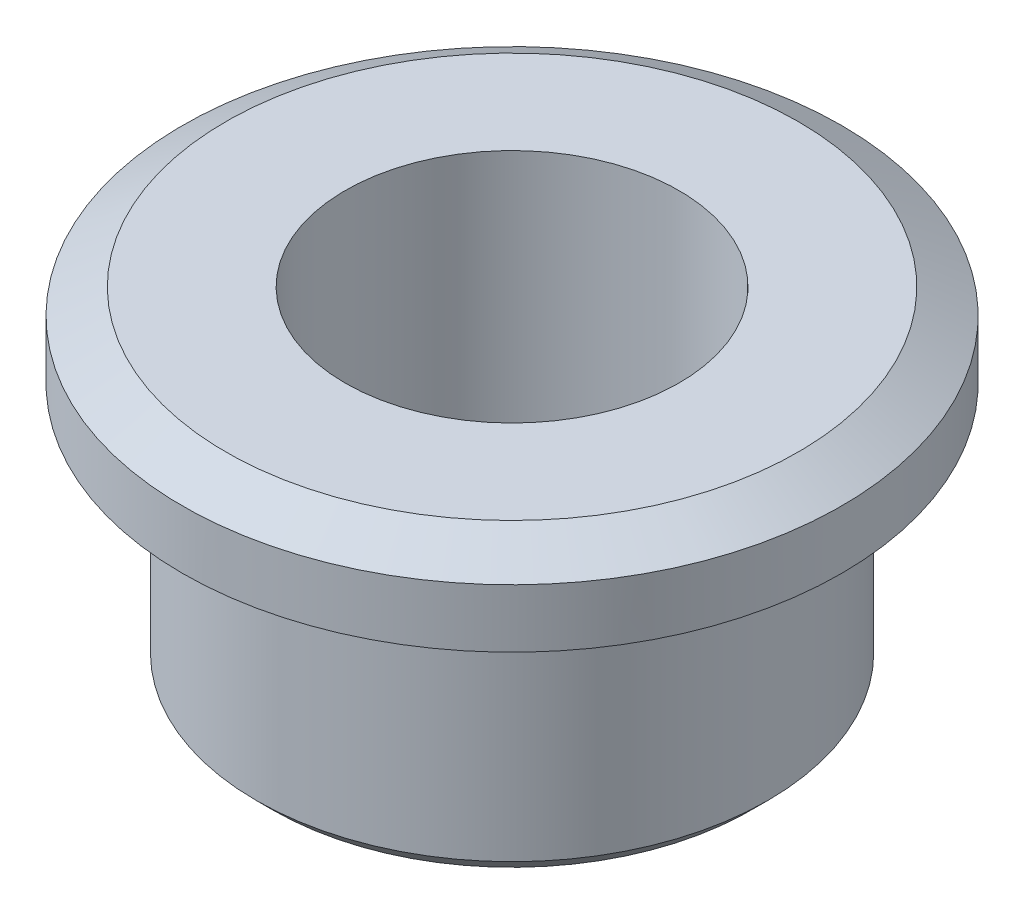
from build123d import *

# Parameters (mm, degrees)
SKETCH_1_R      = 3.065
SKETCH_1_R_2    = 2
EXTRUDE_1_DEPTH = 3
EXTRUDE_START   = 1
SKETCH_2_R      = 3.95
SKETCH_2_R_2    = 2
EXTRUDE_2_DEPTH = 1
CHAMFER_1_SIZE  = 0.3
CHAMFER_1_SIZE2 = 0.519615242
CHAMFER_2_SIZE  = 0.2


with BuildPart() as part:
    # 草图1 → 凸台-拉伸1 (new body)
    with BuildSketch(Plane(origin=(0, 0, 0), x_dir=(1, 0, 0), z_dir=(0, 1, 0))):
        with Locations(Location((0, 0, 0), (0, 0, 270))):
            Circle(SKETCH_1_R)
        with Locations(Location((0, 0, 0), (0, 0, 270))):
            Circle(SKETCH_1_R_2, mode=Mode.SUBTRACT)
    extrude(amount=-EXTRUDE_1_DEPTH)

    # 草图2 → 凸台-拉伸2 (add)
    with BuildSketch(Plane(origin=(0, 0, 0), x_dir=(1, 0, 0), z_dir=(0, 1, 0)).offset(EXTRUDE_START)):
        with Locations(Location((0, 0, 0), (0, 0, 270))):
            Circle(SKETCH_2_R)
        with Locations(Location((0, 0, 0), (0, 0, 270))):
            Circle(SKETCH_2_R_2, mode=Mode.SUBTRACT)
    extrude(amount=-EXTRUDE_2_DEPTH)

    # 倒角1
    chamfer_1_edges = [part.edges().sort_by_distance(p)[0] for p in [
        (0, 1, -3.95),
    ]]
    chamfer_1_side = [part.faces().sort_by_distance(p)[0] for p in [
        (0, 0.5, -3.95),
    ]]
    chamfer(chamfer_1_edges, length=CHAMFER_1_SIZE, length2=CHAMFER_1_SIZE2, reference=chamfer_1_side[0])

    # 倒角2
    chamfer_2_edges = [part.edges().sort_by_distance(p)[0] for p in [
        (0, -3, -3.065),
    ]]
    chamfer(chamfer_2_edges, length=CHAMFER_2_SIZE)


solid = part.part
